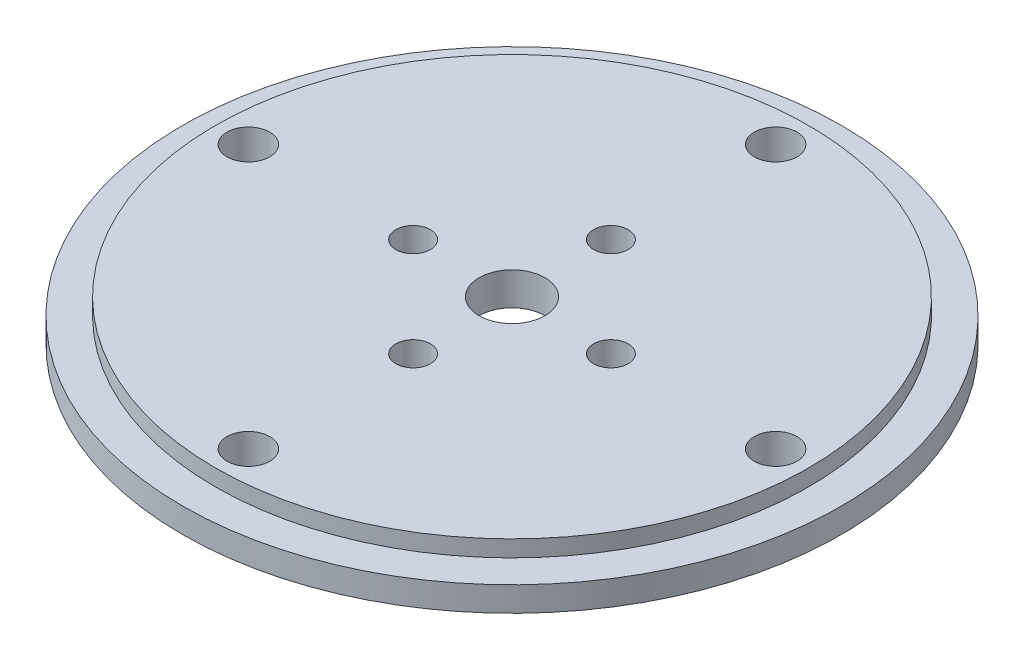
from build123d import *

# Parameters (mm, degrees)
SKETCH_1_R               = 40
EXTRUDE_1_DEPTH          = 3
SKETCH_2_R               = 36
EXTRUDE_2_DEPTH          = 2
CUT_EXTRUDE_1_DEPTH      = 57.789083458
CUT_EXTRUDE_1_DEPTH_BACK = 57.789083458
SKETCH_3_R               = 2.1
SKETCH_3_R_2             = 4
SKETCH_4_R               = 16.1
CUT_EXTRUDE_2_DEPTH      = 1
SKETCH_5_R               = 2.6
CUT_EXTRUDE_3_DEPTH      = 57.789083458
SKETCH_6_R               = 5
CUT_EXTRUDE_4_DEPTH      = 1


with BuildPart() as part:
    # 草图1 → 凸台-拉伸1 (new body)
    with BuildSketch(Plane(origin=(0, 0, 0), x_dir=(1, 0, 0), z_dir=(0, 1, 0))):
        with Locations(Location((0, 0, 0), (0, 0, 270))):
            Circle(SKETCH_1_R)
    extrude(amount=EXTRUDE_1_DEPTH)

    # 草图2 → 凸台-拉伸2 (add)
    with BuildSketch(Plane(origin=(0, 3, 0), x_dir=(1, 0, 0), z_dir=(0, 1, 0))):
        with Locations(Location((0, 0, 0), (0, 0, 270))):
            Circle(SKETCH_2_R)
    extrude(amount=EXTRUDE_2_DEPTH)

    # 草图3 → 切除-拉伸1 (cut, two sides: drawn at the far end of the back side and taken through both)
    with BuildSketch(Plane.XZ.offset(-CUT_EXTRUDE_1_DEPTH_BACK)):
        with Locations(Location((-12, 0, 0), (0, 0, 270))):
            Circle(SKETCH_3_R)
        with Locations(Location((0, 12, 0), (0, 0, 270))):
            Circle(SKETCH_3_R)
        with Locations(Location((12, 0, 0), (0, 0, 270))):
            Circle(SKETCH_3_R)
        with Locations(Location((0, -12, 0), (0, 0, 270))):
            Circle(SKETCH_3_R)
        with Locations(Location((0, 0, 0), (0, 0, 270))):
            Circle(SKETCH_3_R_2)
    extrude(amount=CUT_EXTRUDE_1_DEPTH + CUT_EXTRUDE_1_DEPTH_BACK, mode=Mode.SUBTRACT)

    # 草图4 → 切除-拉伸2 (cut)
    with BuildSketch(Plane.XZ):
        with Locations(Location((0, 0, 0), (0, 0, 270))):
            Circle(SKETCH_4_R)
    extrude(amount=-CUT_EXTRUDE_2_DEPTH, mode=Mode.SUBTRACT)

    # 草图5 → 切除-拉伸3 (cut, through all)
    with BuildSketch(Plane.XZ):
        with Locations(Location((-32, 0, 0), (0, 0, 270))):
            Circle(SKETCH_5_R)
        with Locations(Location((0, 32, 0), (0, 0, 270))):
            Circle(SKETCH_5_R)
        with Locations(Location((32, 0, 0), (0, 0, 270))):
            Circle(SKETCH_5_R)
        with Locations(Location((0, -32, 0), (0, 0, 270))):
            Circle(SKETCH_5_R)
    extrude(amount=-CUT_EXTRUDE_3_DEPTH, mode=Mode.SUBTRACT)

    # 草图6 → 切除-拉伸4 (cut)
    with BuildSketch(Plane.XZ):
        with Locations(Location((0, -32, 0), (0, 0, 270))):
            Circle(SKETCH_6_R)
        with Locations(Location((32, 0, 0), (0, 0, 270))):
            Circle(SKETCH_6_R)
        with Locations(Location((0, 32, 0), (0, 0, 270))):
            Circle(SKETCH_6_R)
        with Locations(Location((-32, 0, 0), (0, 0, 270))):
            Circle(SKETCH_6_R)
    extrude(amount=-CUT_EXTRUDE_4_DEPTH, mode=Mode.SUBTRACT)


solid = part.part
